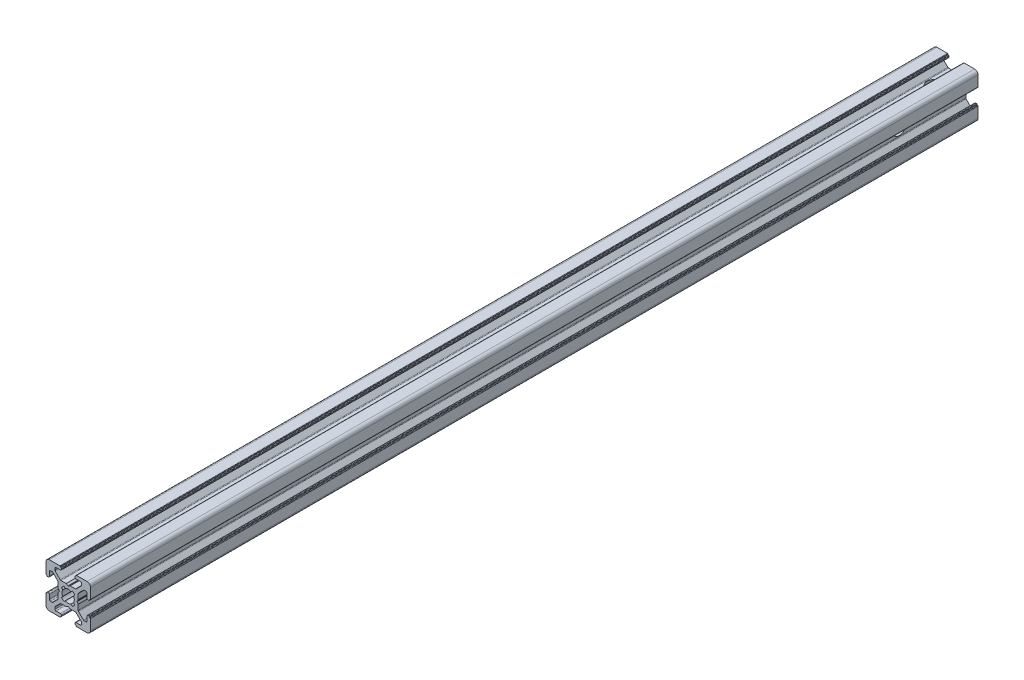
from build123d import *

# Parameters (mm, degrees)
EXTRUDE1_DEPTH = 400
CROQUIS1_R     = 3
BARRENO1_DEPTH = 30
CROQUIS2_R     = 3
BARRENO2_DEPTH = 30


with BuildPart() as part:
    # Sketch1 → Extrude1 (new body)
    with BuildSketch(Plane.XY):
        with BuildLine():
            Line((-3.5, 8.499999673), (-5.500000686, 8.499999673))
            ThreePointArc((-5.500000686, 8.499999673), (-5.853554077, 8.353553064), (-6.000000686, 7.999999673))
            Line((-6.000000686, 7.999999673), (-6.000000686, 7.267766626))
            ThreePointArc((-6.000000686, 7.267766626), (-5.961940448, 7.076424899), (-5.853554059, 6.914213219))
            Line((-5.853554059, 6.914213219), (-3.585787212, 4.646446592))
            ThreePointArc((-3.585787212, 4.646446592), (-3.423575544, 4.538060229), (-3.232233839, 4.5))
            Line((-3.232233839, 4.5), (-0.953590312, 4.5))
            ThreePointArc((-0.953590312, 4.5), (-0.901826505, 4.493185166), (-0.853590316, 4.473205083))
            Line((-0.853590316, 4.473205083), (-0.100000045, 4.038119562))
            ThreePointArc((-0.100000045, 4.038119562), (0, 4.011324632), (0.100000045, 4.038119562))
            Line((0.100000045, 4.038119562), (0.853590316, 4.473205083))
            ThreePointArc((0.853590316, 4.473205083), (0.901826505, 4.493185166), (0.953590312, 4.5))
            Line((0.953590312, 4.5), (3.232233839, 4.5))
            ThreePointArc((3.232233839, 4.5), (3.423575544, 4.538060229), (3.585787212, 4.646446592))
            Line((3.585787212, 4.646446592), (5.853554059, 6.914213219))
            ThreePointArc((5.853554059, 6.914213219), (5.961940448, 7.076424899), (6.000000686, 7.267766626))
            Line((6.000000686, 7.267766626), (6.000000686, 7.999999673))
            ThreePointArc((6.000000686, 7.999999673), (5.853554077, 8.353553064), (5.500000686, 8.499999673))
            Line((5.500000686, 8.499999673), (3.5, 8.499999673))
            ThreePointArc((3.5, 8.499999673), (3.146446609, 8.646446283), (3, 8.999999673))
            Line((3, 8.999999673), (3, 9.3))
            ThreePointArc((3, 9.3), (3.058578644, 9.441421356), (3.2, 9.5))
            Line((3.2, 9.5), (3.350000228, 9.5))
            ThreePointArc((3.350000228, 9.5), (3.491421584, 9.558578644), (3.550000228, 9.7))
            Line((3.550000228, 9.7), (3.550000228, 9.8))
            ThreePointArc((3.550000228, 9.8), (3.608578871, 9.941421356), (3.750000228, 10))
            Line((3.750000228, 10), (8.5, 10))
            ThreePointArc((8.5, 10), (9.560660172, 9.560660172), (10, 8.5))
            Line((10, 8.5), (10, 3.749999605))
            ThreePointArc((10, 3.749999605), (9.941421356, 3.608578248), (9.8, 3.549999605))
            Line((9.8, 3.549999605), (9.699999732, 3.549999605))
            ThreePointArc((9.699999732, 3.549999605), (9.558578376, 3.491420961), (9.499999732, 3.349999605))
            Line((9.499999732, 3.349999605), (9.499999732, 3.2))
            ThreePointArc((9.499999732, 3.2), (9.441421088, 3.058578644), (9.299999732, 3))
            Line((9.299999732, 3), (8.999999732, 3))
            ThreePointArc((8.999999732, 3), (8.646446341, 3.146446609), (8.499999732, 3.5))
            Line((8.499999732, 3.5), (8.499999732, 5.499999605))
            ThreePointArc((8.499999732, 5.499999605), (8.353553123, 5.853552995), (7.999999732, 5.999999605))
            Line((7.999999732, 5.999999605), (7.267766685, 5.999999605))
            ThreePointArc((7.267766685, 5.999999605), (7.076424969, 5.961939371), (6.914213294, 5.853552995))
            Line((6.914213294, 5.853552995), (4.646446398, 3.585786099))
            ThreePointArc((4.646446398, 3.585786099), (4.538060023, 3.423574425), (4.499999789, 3.232232708))
            Line((4.499999789, 3.232232708), (4.499999789, 0.953589302))
            ThreePointArc((4.499999789, 0.953589302), (4.493184953, 0.90182549), (4.473204867, 0.853589297))
            Line((4.473204867, 0.853589297), (4.038119841, 0.099999969))
            ThreePointArc((4.038119841, 0.099999969), (4.011324929, 0), (4.038119841, -0.099999969))
            Line((4.038119841, -0.099999969), (4.473204867, -0.853589297))
            ThreePointArc((4.473204867, -0.853589297), (4.493184953, -0.90182549), (4.499999789, -0.953589302))
            Line((4.499999789, -0.953589302), (4.499999789, -3.232232708))
            ThreePointArc((4.499999789, -3.232232708), (4.538060023, -3.423574425), (4.646446398, -3.585786099))
            Line((4.646446398, -3.585786099), (6.914213294, -5.853552995))
            ThreePointArc((6.914213294, -5.853552995), (7.076424969, -5.961939371), (7.267766685, -5.999999605))
            Line((7.267766685, -5.999999605), (7.999999732, -5.999999605))
            ThreePointArc((7.999999732, -5.999999605), (8.353553123, -5.853552995), (8.499999732, -5.499999605))
            Line((8.499999732, -5.499999605), (8.499999732, -3.5))
            ThreePointArc((8.499999732, -3.5), (8.646446341, -3.146446609), (8.999999732, -3))
            Line((8.999999732, -3), (9.299999732, -3))
            ThreePointArc((9.299999732, -3), (9.441421088, -3.058578644), (9.499999732, -3.2))
            Line((9.499999732, -3.2), (9.499999732, -3.349999605))
            ThreePointArc((9.499999732, -3.349999605), (9.558578376, -3.491420961), (9.699999732, -3.549999605))
            Line((9.699999732, -3.549999605), (9.8, -3.549999605))
            ThreePointArc((9.8, -3.549999605), (9.941421356, -3.608578248), (10, -3.749999605))
            Line((10, -3.749999605), (10, -8.5))
            ThreePointArc((10, -8.5), (9.560660172, -9.560660172), (8.5, -10))
            Line((8.5, -10), (3.750000228, -10))
            ThreePointArc((3.750000228, -10), (3.608578871, -9.941421356), (3.550000228, -9.8))
            Line((3.550000228, -9.8), (3.550000228, -9.7))
            ThreePointArc((3.550000228, -9.7), (3.491421584, -9.558578644), (3.350000228, -9.5))
            Line((3.350000228, -9.5), (3.2, -9.5))
            ThreePointArc((3.2, -9.5), (3.058578644, -9.441421356), (3, -9.3))
            Line((3, -9.3), (3, -8.999999673))
            ThreePointArc((3, -8.999999673), (3.146446609, -8.646446283), (3.5, -8.499999673))
            Line((3.5, -8.499999673), (5.500000686, -8.499999673))
            ThreePointArc((5.500000686, -8.499999673), (5.853554077, -8.353553064), (6.000000686, -7.999999673))
            Line((6.000000686, -7.999999673), (6.000000686, -7.267766626))
            ThreePointArc((6.000000686, -7.267766626), (5.961940448, -7.076424899), (5.853554059, -6.914213219))
            Line((5.853554059, -6.914213219), (3.585787212, -4.646446592))
            ThreePointArc((3.585787212, -4.646446592), (3.423575544, -4.538060229), (3.232233839, -4.5))
            Line((3.232233839, -4.5), (0.953590312, -4.5))
            ThreePointArc((0.953590312, -4.5), (0.901826505, -4.493185166), (0.853590316, -4.473205083))
            Line((0.853590316, -4.473205083), (0.100000045, -4.038119562))
            ThreePointArc((0.100000045, -4.038119562), (0, -4.011324632), (-0.100000045, -4.038119562))
            Line((-0.100000045, -4.038119562), (-0.853590316, -4.473205083))
            ThreePointArc((-0.853590316, -4.473205083), (-0.901826505, -4.493185166), (-0.953590312, -4.5))
            Line((-0.953590312, -4.5), (-3.232233839, -4.5))
            ThreePointArc((-3.232233839, -4.5), (-3.423575544, -4.538060229), (-3.585787212, -4.646446592))
            Line((-3.585787212, -4.646446592), (-5.853554059, -6.914213219))
            ThreePointArc((-5.853554059, -6.914213219), (-5.961940448, -7.076424899), (-6.000000686, -7.267766626))
            Line((-6.000000686, -7.267766626), (-6.000000686, -7.999999673))
            ThreePointArc((-6.000000686, -7.999999673), (-5.853554077, -8.353553064), (-5.500000686, -8.499999673))
            Line((-5.500000686, -8.499999673), (-3.5, -8.499999673))
            ThreePointArc((-3.5, -8.499999673), (-3.146446609, -8.646446283), (-3, -8.999999673))
            Line((-3, -8.999999673), (-3, -9.3))
            ThreePointArc((-3, -9.3), (-3.058578644, -9.441421356), (-3.2, -9.5))
            Line((-3.2, -9.5), (-3.350000228, -9.5))
            ThreePointArc((-3.350000228, -9.5), (-3.491421584, -9.558578644), (-3.550000228, -9.7))
            Line((-3.550000228, -9.7), (-3.550000228, -9.8))
            ThreePointArc((-3.550000228, -9.8), (-3.608578871, -9.941421356), (-3.750000228, -10))
            Line((-3.750000228, -10), (-8.5, -10))
            ThreePointArc((-8.5, -10), (-9.560660172, -9.560660172), (-10, -8.5))
            Line((-10, -8.5), (-10, -3.749999605))
            ThreePointArc((-10, -3.749999605), (-9.941421356, -3.608578248), (-9.8, -3.549999605))
            Line((-9.8, -3.549999605), (-9.699999732, -3.549999605))
            ThreePointArc((-9.699999732, -3.549999605), (-9.558578376, -3.491420961), (-9.499999732, -3.349999605))
            Line((-9.499999732, -3.349999605), (-9.499999732, -3.2))
            ThreePointArc((-9.499999732, -3.2), (-9.441421088, -3.058578644), (-9.299999732, -3))
            Line((-9.299999732, -3), (-8.999999732, -3))
            ThreePointArc((-8.999999732, -3), (-8.646446341, -3.146446609), (-8.499999732, -3.5))
            Line((-8.499999732, -3.5), (-8.499999732, -5.499999605))
            ThreePointArc((-8.499999732, -5.499999605), (-8.353553123, -5.853552995), (-7.999999732, -5.999999605))
            Line((-7.999999732, -5.999999605), (-7.267766685, -5.999999605))
            ThreePointArc((-7.267766685, -5.999999605), (-7.076424969, -5.961939371), (-6.914213294, -5.853552995))
            Line((-6.914213294, -5.853552995), (-4.646446398, -3.585786099))
            ThreePointArc((-4.646446398, -3.585786099), (-4.538060023, -3.423574425), (-4.499999789, -3.232232708))
            Line((-4.499999789, -3.232232708), (-4.499999789, -0.953589302))
            ThreePointArc((-4.499999789, -0.953589302), (-4.493184953, -0.90182549), (-4.473204867, -0.853589297))
            Line((-4.473204867, -0.853589297), (-4.038119841, -0.099999969))
            ThreePointArc((-4.038119841, -0.099999969), (-4.011324929, 0), (-4.038119841, 0.099999969))
            Line((-4.038119841, 0.099999969), (-4.473204867, 0.853589297))
            ThreePointArc((-4.473204867, 0.853589297), (-4.493184953, 0.90182549), (-4.499999789, 0.953589302))
            Line((-4.499999789, 0.953589302), (-4.499999789, 3.232232708))
            ThreePointArc((-4.499999789, 3.232232708), (-4.538060023, 3.423574425), (-4.646446398, 3.585786099))
            Line((-4.646446398, 3.585786099), (-6.914213294, 5.853552995))
            ThreePointArc((-6.914213294, 5.853552995), (-7.076424969, 5.961939371), (-7.267766685, 5.999999605))
            Line((-7.267766685, 5.999999605), (-7.999999732, 5.999999605))
            ThreePointArc((-7.999999732, 5.999999605), (-8.353553123, 5.853552995), (-8.499999732, 5.499999605))
            Line((-8.499999732, 5.499999605), (-8.499999732, 3.5))
            ThreePointArc((-8.499999732, 3.5), (-8.646446341, 3.146446609), (-8.999999732, 3))
            Line((-8.999999732, 3), (-9.299999732, 3))
            ThreePointArc((-9.299999732, 3), (-9.441421088, 3.058578644), (-9.499999732, 3.2))
            Line((-9.499999732, 3.2), (-9.499999732, 3.349999605))
            ThreePointArc((-9.499999732, 3.349999605), (-9.558578376, 3.491420961), (-9.699999732, 3.549999605))
            Line((-9.699999732, 3.549999605), (-9.8, 3.549999605))
            ThreePointArc((-9.8, 3.549999605), (-9.941421356, 3.608578248), (-10, 3.749999605))
            Line((-10, 3.749999605), (-10, 8.5))
            ThreePointArc((-10, 8.5), (-9.560660172, 9.560660172), (-8.5, 10))
            Line((-8.5, 10), (-3.750000228, 10))
            ThreePointArc((-3.750000228, 10), (-3.608578871, 9.941421356), (-3.550000228, 9.8))
            Line((-3.550000228, 9.8), (-3.550000228, 9.7))
            ThreePointArc((-3.550000228, 9.7), (-3.491421584, 9.558578644), (-3.350000228, 9.5))
            Line((-3.350000228, 9.5), (-3.2, 9.5))
            ThreePointArc((-3.2, 9.5), (-3.058578644, 9.441421356), (-3, 9.3))
            Line((-3, 9.3), (-3, 8.999999673))
            ThreePointArc((-3, 8.999999673), (-3.146446609, 8.646446283), (-3.5, 8.499999673))
        make_face()
        with BuildLine():
            Line((-1.258185436, 2.445295362), (-1.91389502, 2.989640962))
            ThreePointArc((-1.91389502, 2.989640962), (-2.511737261, 2.508410485), (-2.992174953, 1.909930962))
            Line((-2.992174953, 1.909930962), (-2.445295423, 1.258185317))
            ThreePointArc((-2.445295423, 1.258185317), (-2.75, 0), (-2.445295423, -1.258185317))
            Line((-2.445295423, -1.258185317), (-2.992174953, -1.909930962))
            ThreePointArc((-2.992174953, -1.909930962), (-2.511737261, -2.508410485), (-1.91389502, -2.989640962))
            Line((-1.91389502, -2.989640962), (-1.258185436, -2.445295362))
            ThreePointArc((-1.258185436, -2.445295362), (0, -2.75), (1.258185436, -2.445295362))
            Line((1.258185436, -2.445295362), (1.91389502, -2.989640962))
            ThreePointArc((1.91389502, -2.989640962), (2.511737261, -2.508410485), (2.992174953, -1.909930962))
            Line((2.992174953, -1.909930962), (2.445295423, -1.258185317))
            ThreePointArc((2.445295423, -1.258185317), (2.75, 0), (2.445295423, 1.258185317))
            Line((2.445295423, 1.258185317), (2.992174953, 1.909930962))
            ThreePointArc((2.992174953, 1.909930962), (2.511737261, 2.508410485), (1.91389502, 2.989640962))
            Line((1.91389502, 2.989640962), (1.258185436, 2.445295362))
            ThreePointArc((1.258185436, 2.445295362), (0, 2.75), (-1.258185436, 2.445295362))
        make_face(mode=Mode.SUBTRACT)
    extrude(amount=EXTRUDE1_DEPTH)

    # Croquis1 → Barreno1 (cut)
    with BuildSketch(Plane(origin=(0, -10, 0), x_dir=(-1, 0, 0), z_dir=(0, -1, 0))):
        with Locations(Location((0, -10, 0), (0, 0, 88.089785976))):
            Circle(CROQUIS1_R)
    extrude(amount=-BARRENO1_DEPTH, mode=Mode.SUBTRACT)

    # Croquis2 → Barreno2 (cut)
    with BuildSketch(Plane(origin=(10, 0, 0), x_dir=(0, 0, -1), z_dir=(1, 0, 0))):
        with Locations(Location((-30, 0, 0), (0, 0, 18.533743383))):
            Circle(CROQUIS2_R)
    extrude(amount=-BARRENO2_DEPTH, mode=Mode.SUBTRACT)


solid = part.part
